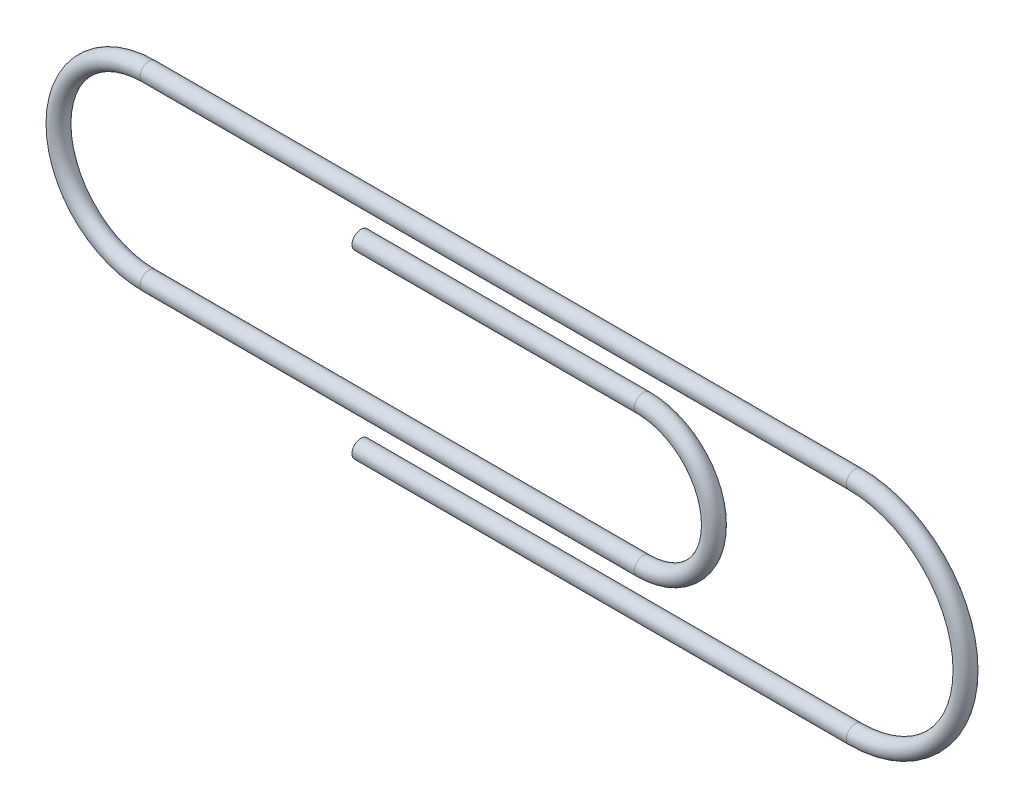
from build123d import *

# Parameters (mm, degrees)
SKETCH2_R = 0.25


with BuildPart() as part:
    # Sweep2: sweep along a path in Sketch1
    with BuildLine(Plane.XY) as sweep2_path:
        Line((0, 0), (8, 0))
        ThreePointArc((8, 0), (10, -2), (8, -4))
        Line((8, -4), (-6, -4))
        ThreePointArc((-6, -4), (-8.5625, -1.4375), (-6, 1.125))
        Line((-6, 1.125), (14, 1.125))
        ThreePointArc((14, 1.125), (17.125, -2), (14, -5.125))
        Line((14, -5.125), (0, -5.125))
    # Sketch2 → Sweep2 (sweep)
    with BuildSketch(Plane(origin=(0, 0, 0), x_dir=(0, 0, -1), z_dir=(1, 0, 0))):
        Circle(SKETCH2_R)
    sweep(path=sweep2_path.line)


solid = part.part
